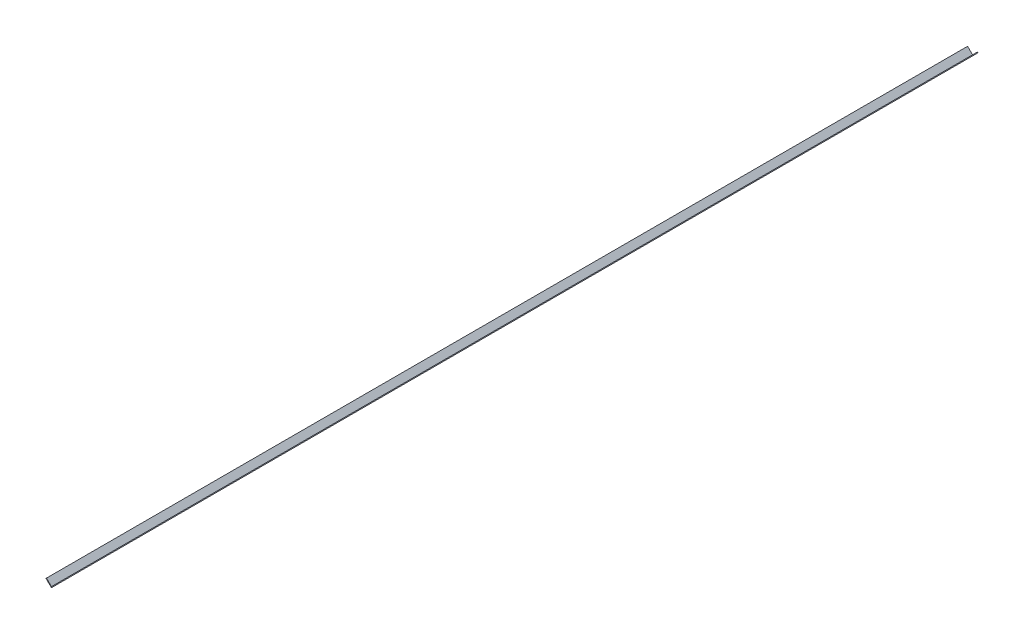
from build123d import *

# Parameters (mm, degrees)
BOSS_EXTRUDE1_DEPTH      = 1600.2
BOSS_EXTRUDE1_DEPTH_BACK = 76.2


with BuildPart() as part:
    # Sketch1 → Boss-Extrude1 (new, two sides: drawn at the far end of the back side and taken through both)
    with BuildSketch(Plane.XY.offset(-BOSS_EXTRUDE1_DEPTH_BACK)):
        Polygon((0, 0), (-8.980256121, 8.980256121), (-9.878281733, 8.082230509), (0, -1.796051224), (9.878281733, 8.082230509), (8.980256121, 8.980256121), align=None)
    extrude(amount=BOSS_EXTRUDE1_DEPTH + BOSS_EXTRUDE1_DEPTH_BACK)


solid = part.part
